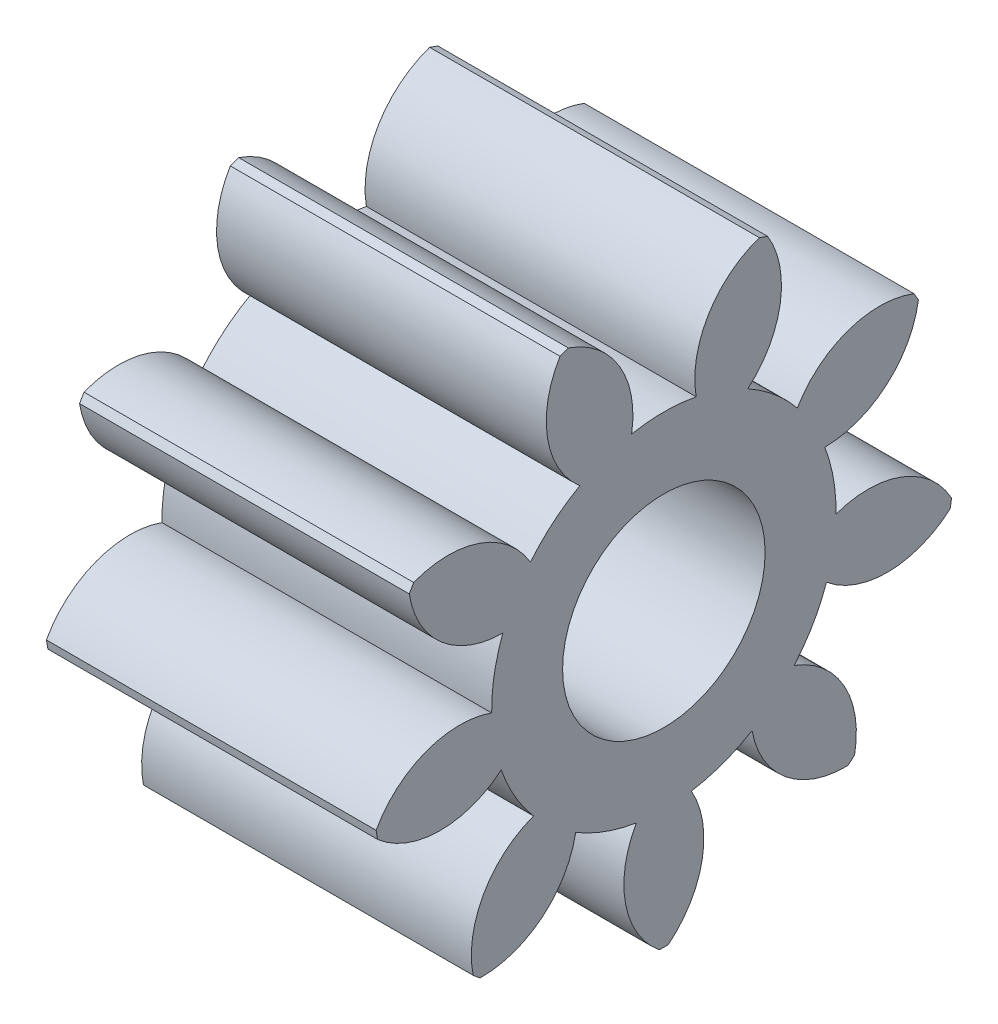
from build123d import *

# Parameters (mm, degrees)
BASPROSKE_W        = 14
BASPROSKE_H        = 12.375
TOOTHCUT_DEPTH     = 23.411632024
TEETHCUTS_COUNT    = 9
TEETHCUTS_ANGLE    = 320
BORSKE_R           = 4
BORE_DEPTH         = 50.0000508
SKETCH1_R          = 4.3
CUT_EXTRUDE1_DEPTH = 23.325486095


with BuildPart() as part:
    # BasProSke → Base-Revolve (revolve)
    with BuildSketch(Plane(origin=(0, 0, 0), x_dir=(1, 0, 0), z_dir=(0, 1, 0)), mode=Mode.PRIVATE) as base_revolve_sk:
        with Locations((7, 6.1875)):
            Rectangle(BASPROSKE_W, BASPROSKE_H)
    revolve(base_revolve_sk.sketch.rotate(Axis((-10, 0, 0), (1, 0, 0)), 180), axis=Axis((-10, 0, 0), (1, 0, 0)))

    # TooCutSke → ToothCut (cut, through all)
    with BuildSketch(Plane(origin=(0, 0, 0), x_dir=(0, 0, -1), z_dir=(1, 0, 0))):
        with BuildLine():
            ThreePointArc((1.370014904, 7.181997731), (0, 7.3115), (-1.370014904, 7.181997731))
            ThreePointArc((-1.370014904, 7.181997731), (-1.893781384, 9.948471899), (-4.094330617, 11.704972318))
            ThreePointArc((-4.094330617, 11.704972318), (0, 12.4004), (4.094330617, 11.704972318))
            ThreePointArc((4.094330617, 11.704972318), (1.893781384, 9.948471899), (1.370014904, 7.181997731))
        make_face()
    toothcut = extrude(amount=TOOTHCUT_DEPTH, mode=Mode.SUBTRACT)

    # TeethCuts: ToothCut ×9 about axis
    teethcuts_axis = Axis((-10, 0, 0), (1, 0, 0))
    for i in range(1, TEETHCUTS_COUNT):
        add(toothcut.rotate(teethcuts_axis, i * TEETHCUTS_ANGLE / (TEETHCUTS_COUNT - 1)), mode=Mode.SUBTRACT)

    # BorSke → Bore (cut, symmetric)
    with BuildSketch(Plane(origin=(0, 0, 0), x_dir=(0, 0, -1), z_dir=(1, 0, 0))):
        with Locations(Location((0, 0, 0), (0, 0, 180))):
            Circle(BORSKE_R)
    extrude(amount=BORE_DEPTH, both=True, mode=Mode.SUBTRACT)

    # Sketch1 → Cut-Extrude1 (cut, through all)
    with BuildSketch(Plane(origin=(14, 0, 0), x_dir=(0, 0, -1), z_dir=(1, 0, 0))):
        Circle(SKETCH1_R)
    extrude(amount=-CUT_EXTRUDE1_DEPTH, mode=Mode.SUBTRACT)


solid = part.part
